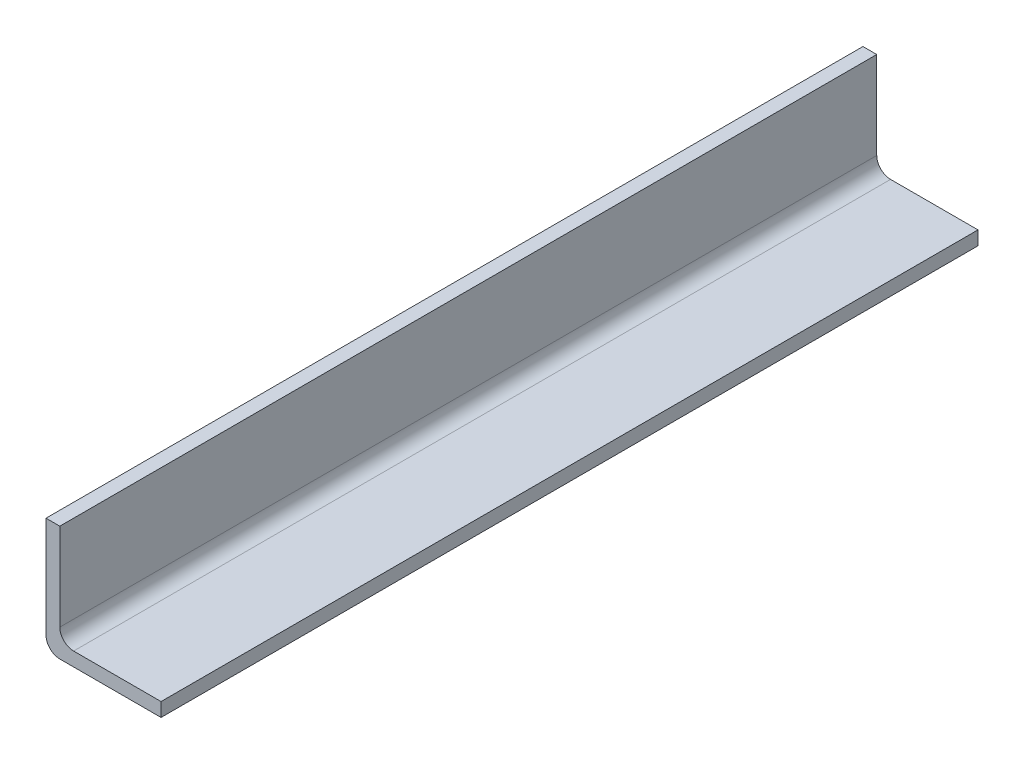
from build123d import *

# Parameters (mm, degrees)
BOSS_EXTRUDE1_DEPTH = 355
FILLET1_R           = 6


with BuildPart() as part:
    # Sketch1 → Boss-Extrude1 (new body)
    with BuildSketch(Plane.XY):
        Polygon((0, 0), (0, 50), (6, 50), (6, 6), (50, 6), (50, 0), align=None)
    extrude(amount=BOSS_EXTRUDE1_DEPTH)

    # Fillet1
    fillet1_edges = [part.edges().sort_by_distance(p)[0] for p in [
        (0, 0, 177.5),
        (6, 6, 177.5),
    ]]
    fillet(fillet1_edges, radius=FILLET1_R)


solid = part.part
